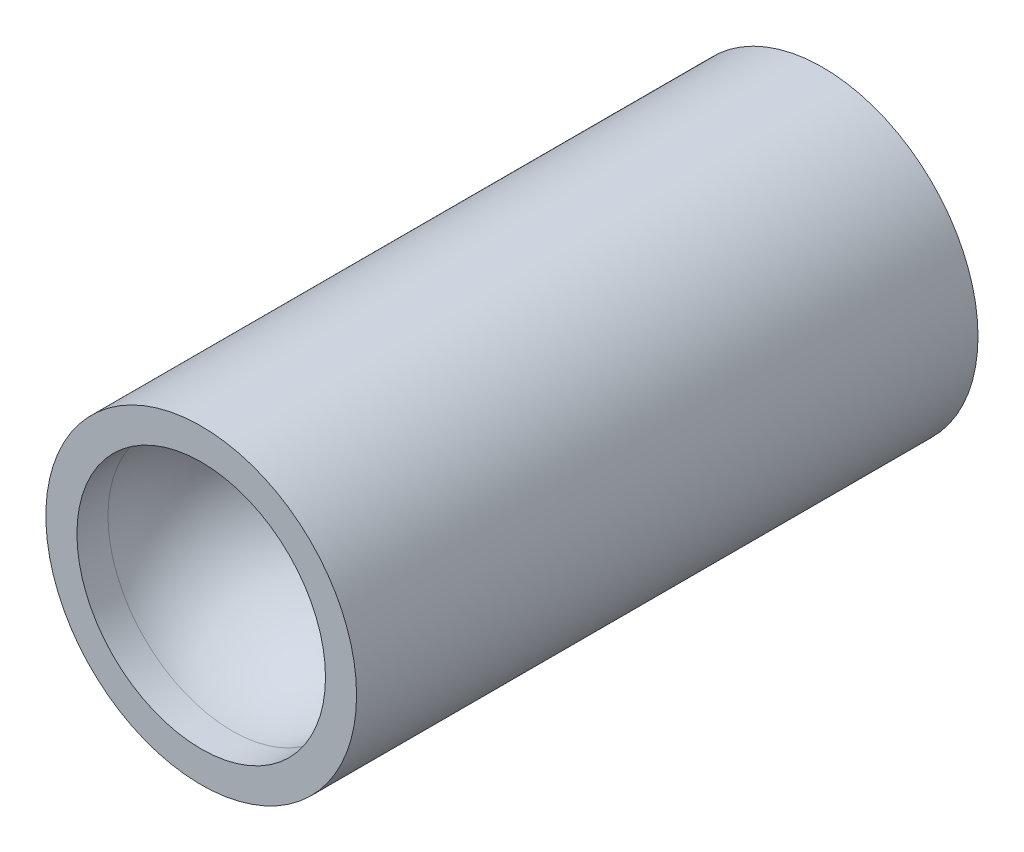
from build123d import *

# Parameters (mm, degrees)
SCHIZZO1_R                   = 5
ESTRUSIONE_ESTRUSIONE1_DEPTH = 20
SCHIZZO2_R                   = 4
TAGLIO_ESTRUSIONE1_DEPTH     = 1


with BuildPart() as part:
    # Schizzo1 → Estrusione-Estrusione1 (new body)
    with BuildSketch(Plane.XY):
        Circle(SCHIZZO1_R)
    extrude(amount=ESTRUSIONE_ESTRUSIONE1_DEPTH)

    # Schizzo2 → Taglio-Estrusione1 (cut)
    with BuildSketch(Plane.XY.offset(20)):
        Circle(SCHIZZO2_R)
    extrude(amount=-TAGLIO_ESTRUSIONE1_DEPTH, mode=Mode.SUBTRACT)

    # Schizzo15 → Taglia-Rivoluzione2 (revolve, cut)
    with BuildSketch(Plane.XY.offset(19)):
        with BuildLine():
            Line((0, -4), (0, 4))
            ThreePointArc((0, 4), (-4, 0), (0, -4))
        make_face()
    revolve(axis=Axis((0, -4, 19), (0, 1, 0)), mode=Mode.SUBTRACT)


solid = part.part
